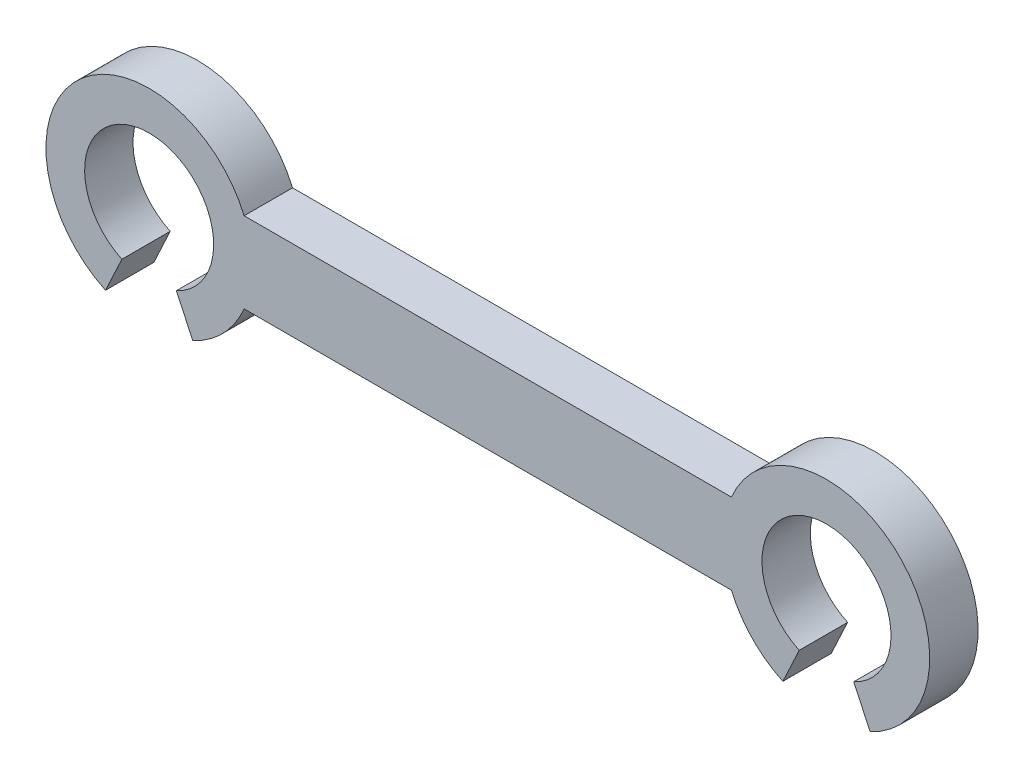
from build123d import *

# Parameters (mm, degrees)
BOSS_EXTRU_1_DEPTH = 1.5


with BuildPart() as part:
    # Esquisse1 → Boss.-Extru.1 (new body)
    with BuildSketch(Plane.XY):
        with BuildLine():
            Line((-11.852378438, -2.900184919), (-11.345236523, -1.812615574))
            ThreePointArc((-11.345236523, -1.812615574), (-12.072600453, 1.235689207), (-8.9387505, 1.25))
            Line((-8.9387505, 1.25), (-7.554240336, 1.25))
            ThreePointArc((-7.554240336, 1.25), (-12.722774088, 2.302015498), (-11.852378438, -2.900184919))
        make_face()
        with BuildLine():
            ThreePointArc((-8.5, 0), (-8.612872686, -0.662382443), (-8.9387505, -1.25))
            Line((-8.9387505, -1.25), (-7.554240336, -1.25))
            ThreePointArc((-7.554240336, -1.25), (-7.364204174, -0.637796627), (-7.3, 0))
            ThreePointArc((-7.3, 0), (-7.364204174, 0.637796627), (-7.554240336, 1.25))
            Line((-7.554240336, 1.25), (-8.9387505, 1.25))
            ThreePointArc((-8.9387505, 1.25), (-8.612872686, 0.662382443), (-8.5, 0))
        make_face()
        with BuildLine():
            ThreePointArc((-7.3, 0), (-7.364204174, -0.637796627), (-7.554240336, -1.25))
            Line((-7.554240336, -1.25), (7.554240336, -1.25))
            ThreePointArc((7.554240336, -1.25), (7.3, 0), (7.554240336, 1.25))
            Line((7.554240336, 1.25), (-7.554240336, 1.25))
            ThreePointArc((-7.554240336, 1.25), (-7.364204174, 0.637796627), (-7.3, 0))
        make_face()
        with BuildLine():
            ThreePointArc((7.554240336, 1.25), (7.3, 0), (7.554240336, -1.25))
            Line((7.554240336, -1.25), (8.9387505, -1.25))
            ThreePointArc((8.9387505, -1.25), (8.5, 0), (8.9387505, 1.25))
            Line((8.9387505, 1.25), (7.554240336, 1.25))
        make_face()
        with BuildLine():
            ThreePointArc((13.7, 0), (11.137796627, 3.135795826), (7.554240336, 1.25))
            Line((7.554240336, 1.25), (8.9387505, 1.25))
            ThreePointArc((8.9387505, 1.25), (11.162382443, 1.887127314), (12.5, 0))
            ThreePointArc((12.5, 0), (12.186782892, -1.074599217), (11.345236523, -1.812615574))
            Line((11.345236523, -1.812615574), (11.852378438, -2.900184919))
            ThreePointArc((11.852378438, -2.900184919), (13.198852627, -1.719358747), (13.7, 0))
        make_face()
        with BuildLine():
            ThreePointArc((-8.9387505, -1.25), (-9.264310793, -1.572600453), (-9.654763477, -1.812615574))
            Line((-9.654763477, -1.812615574), (-9.147621562, -2.900184919))
            ThreePointArc((-9.147621562, -2.900184919), (-8.197984502, -2.222774088), (-7.554240336, -1.25))
            Line((-7.554240336, -1.25), (-8.9387505, -1.25))
        make_face()
        with BuildLine():
            Line((8.9387505, -1.25), (7.554240336, -1.25))
            ThreePointArc((7.554240336, -1.25), (8.197984502, -2.222774088), (9.147621562, -2.900184919))
            Line((9.147621562, -2.900184919), (9.654763477, -1.812615574))
            ThreePointArc((9.654763477, -1.812615574), (9.264310793, -1.572600453), (8.9387505, -1.25))
        make_face()
    extrude(amount=BOSS_EXTRU_1_DEPTH)


solid = part.part
